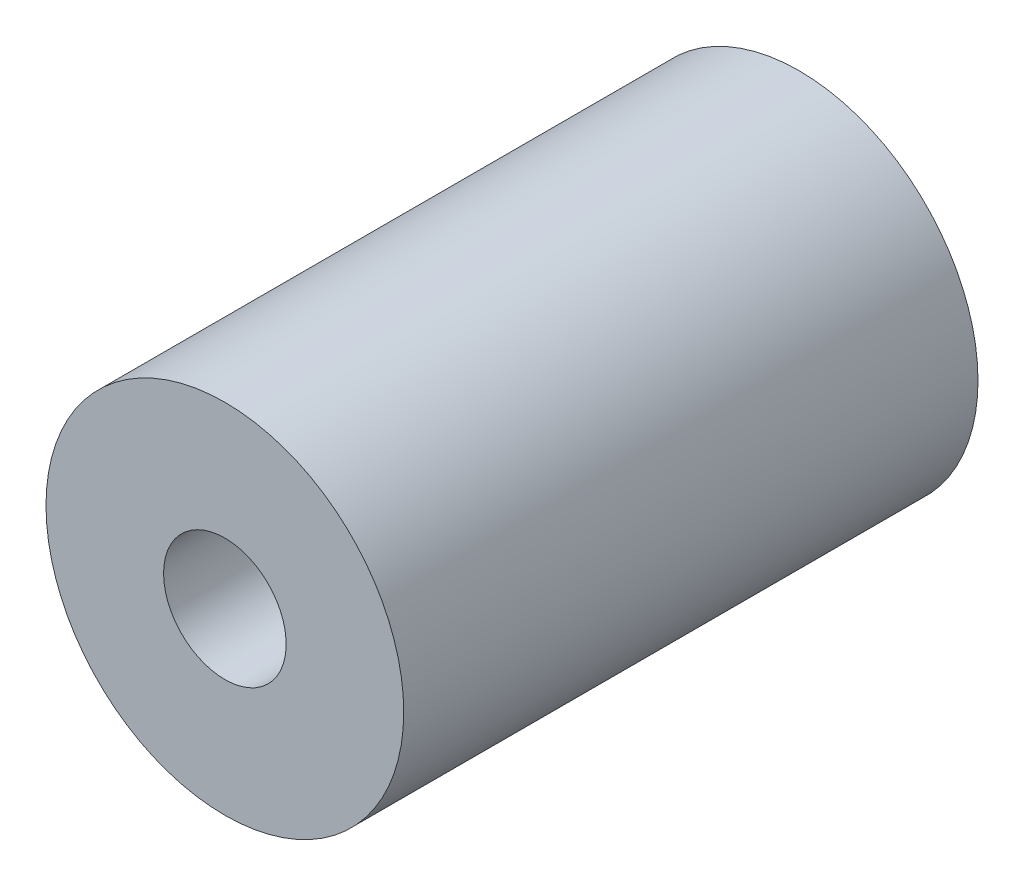
from build123d import *

# Parameters (mm, degrees)
SKETCH1_W = 30.5816
SKETCH1_H = 6.2611


with BuildPart() as part:
    # Sketch1 → Revolve1 (revolve)
    with BuildSketch(Plane(origin=(0, 0, 0), x_dir=(0, 0, -1), z_dir=(1, 0, 0)), mode=Mode.PRIVATE) as revolve1_sk:
        with Locations((0, 6.39445)):
            Rectangle(SKETCH1_W, SKETCH1_H)
    revolve(revolve1_sk.sketch.rotate(Axis((0, 0, -21.730881676), (0, 0, 1)), 90), axis=Axis((0, 0, -21.730881676), (0, 0, 1)))


solid = part.part
